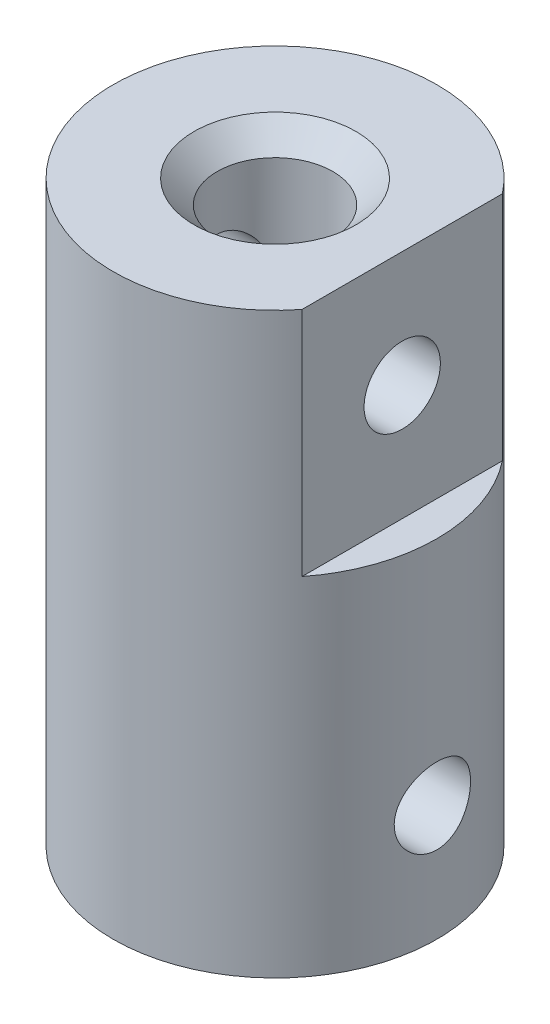
from build123d import *

# Parameters (mm, degrees)
SKETCH1_W               = 4.5
SKETCH1_H               = 25
CUT_EXTRUDE1_DEPTH      = 27.888659319
CUT_EXTRUDE1_DEPTH_BACK = 27.888659319
SKETCH2_W               = 1.5
SKETCH2_H               = 10
CHAMFER1_SIZE           = 1
M8_TAPPED_HOLE1_D       = 6.8
M8_TAPPED_HOLE1_DEPTH   = 16
M8_TAPPED_HOLE1_TIP     = 2.042926105
M4_TAPPED_HOLE1_D       = 3.3


with BuildPart() as part:
    # Sketch1 → Revolve1 (revolve)
    with BuildSketch(Plane.XY, mode=Mode.PRIVATE) as revolve1_sk:
        with Locations((-4.75, 12.5)):
            Rectangle(SKETCH1_W, SKETCH1_H)
    revolve(revolve1_sk.sketch.rotate(Axis((0, 0, 0), (0, 1, 0)), 270), axis=Axis((0, 0, 0), (0, 1, 0)))

    # Sketch2 → Cut-Extrude1 (cut, two sides: drawn at the far end of the back side and taken through both)
    with BuildSketch(Plane.XY.offset(-CUT_EXTRUDE1_DEPTH_BACK)):
        with Locations((6.25, 20)):
            Rectangle(SKETCH2_W, SKETCH2_H)
    extrude(amount=CUT_EXTRUDE1_DEPTH + CUT_EXTRUDE1_DEPTH_BACK, mode=Mode.SUBTRACT)

    # Chamfer1
    chamfer1_edges = [part.edges().sort_by_distance(p)[0] for p in [
        (0, 25, 2.5),
    ]]
    chamfer(chamfer1_edges, length=CHAMFER1_SIZE)

    # M8 Tapped Hole1
    with Locations(Plane(origin=(0, 0, 0), x_dir=(-1, 0, 0), z_dir=(0, -1, 0))):
        with Locations((0, 0)):
            Hole(M8_TAPPED_HOLE1_D / 2, depth=M8_TAPPED_HOLE1_DEPTH)
            with Locations((0, 0, -(M8_TAPPED_HOLE1_DEPTH + M8_TAPPED_HOLE1_TIP / 2))):  # 118° drill point
                Cone(0, M8_TAPPED_HOLE1_D / 2, M8_TAPPED_HOLE1_TIP, mode=Mode.SUBTRACT)

    # M4 Tapped Hole1 (through all)
    with Locations(Plane(origin=(7, 0, 0), x_dir=(0, 0, -1), z_dir=(1, 0, 0))):
        with Locations((0, 20), (0, 5)):
            Hole(M4_TAPPED_HOLE1_D / 2)


solid = part.part
